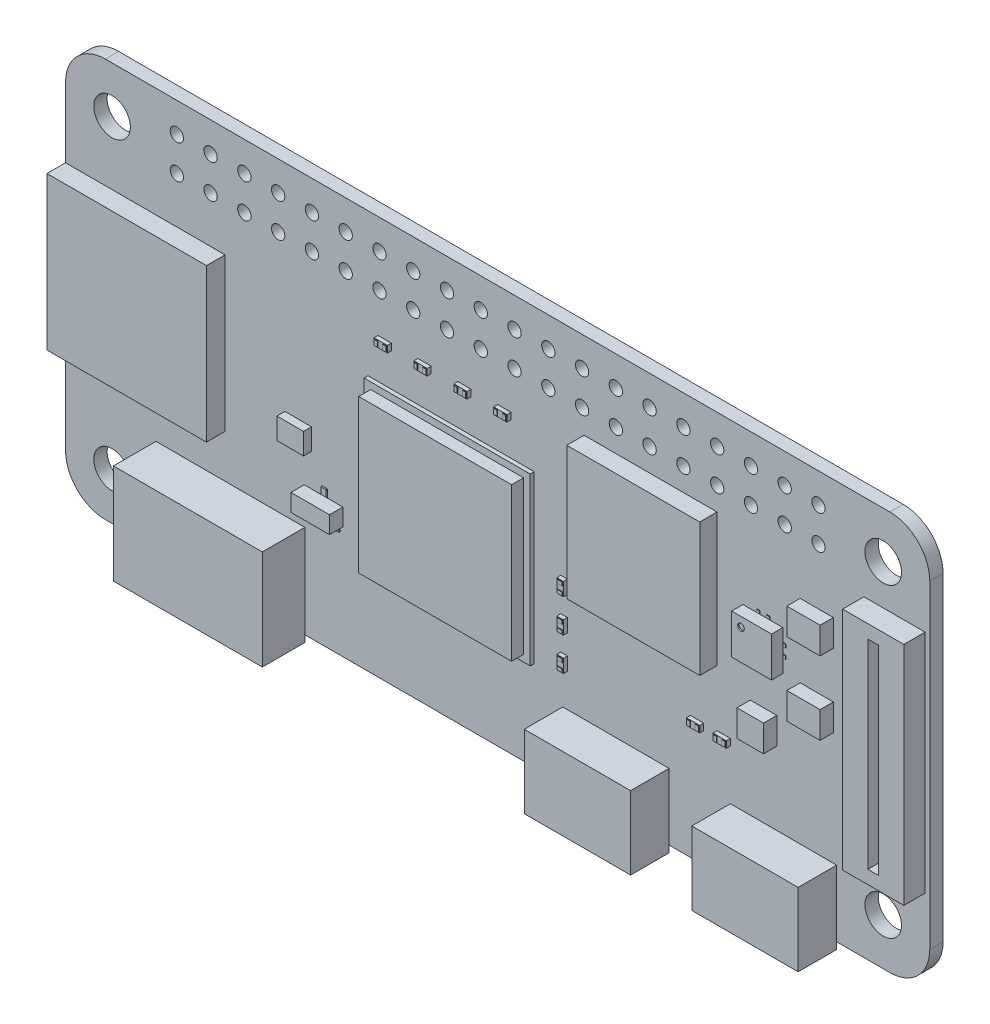
from build123d import *

# Parameters (mm, degrees)
PCB_DEPTH       = 1
SKETCH2_W       = 0.25
SKETCH2_H       = 0.3
SKETCH2_W_2     = 0.3
SKETCH2_H_2     = 0.25
SMD_ADD00_DEPTH = 0.05
SKETCH3_W       = 0.4
SKETCH3_H       = 0.7
SMD_ADD01_DEPTH = 0.1
SKETCH4_W       = 12.5
SKETCH4_H       = 12.5
SKETCH4_W_2     = 0.5
SKETCH4_H_2     = 1
SKETCH4_W_3     = 1
SKETCH4_H_3     = 0.5
SMD_ADD02_DEPTH = 0.3
SKETCH5_W       = 2
SKETCH5_H       = 1.6
SMD_ADD03_DEPTH = 0.6
SKETCH6_W       = 2.5
SKETCH6_H       = 2
SKETCH6_W_2     = 2
SMD_ADD04_DEPTH = 1
SKETCH7_W       = 10
SKETCH7_H       = 10
SMD_ADD05_DEPTH = 1.3
SKETCH8_W       = 12
SKETCH8_H       = 11.5
SMD_ADD06_DEPTH = 1.4
SKETCH9_W       = 4.6
SKETCH9_H       = 17
SMD_ADD07_DEPTH = 1.6
SKETCH10_W      = 8
SKETCH10_H      = 5.5
SMD_ADD08_DEPTH = 2.9
SKETCH11_W      = 11.2
SKETCH11_H      = 7.5
SMD_ADD09_DEPTH = 3.2
SKETCH12_W      = 3
SKETCH12_H      = 3
SMD_ADD10_DEPTH = 0.85
SKETCH13_W      = 2.9
SKETCH13_H      = 1.3
SMD_ADD11_DEPTH = 1
SKETCH14_W      = 0.4
SKETCH14_H      = 0.25
SKETCH14_W_2    = 0.25
SKETCH14_H_2    = 0.4
SMD_ADD12_DEPTH = 0.05
SKETCH15_W      = 11.5
SKETCH15_H      = 11.5
SMD_ADD13_DEPTH = 0.9
SKETCH16_W      = 4.2
SKETCH16_H      = 0.6
SMD_CUT00_DEPTH = 0.5
SKETCH17_W      = 5.5
SKETCH17_H      = 2
SKETCH17_W_2    = 4.2
SKETCH17_H_2    = 0.6
SMD_CUT01_DEPTH = 7
SKETCH18_R      = 0.25
SMD_CUT02_DEPTH = 0.1
SKETCH19_W      = 0.8
SKETCH19_H      = 15
SMD_CUT03_DEPTH = 1.1
SKETCH20_R      = 1.375
SKETCH20_R_2    = 0.5
HOLES_DEPTH     = 1


with BuildPart() as part:
    # Sketch1 → PCB (new body)
    with BuildSketch(Plane.XY):
        with BuildLine():
            Line((3, 0), (62, 0))
            ThreePointArc((62, 0), (64.121320344, 0.878679656), (65, 3))
            Line((65, 3), (65, 27))
            ThreePointArc((65, 27), (64.121320344, 29.121320344), (62, 30))
            Line((62, 30), (3, 30))
            ThreePointArc((3, 30), (0.878679656, 29.121320344), (0, 27))
            Line((0, 27), (0, 3))
            ThreePointArc((0, 3), (0.878679656, 0.878679656), (3, 0))
        make_face()
    extrude(amount=PCB_DEPTH)

    # Sketch2 → SMD_add00 (add)
    with BuildSketch(Plane.XY.offset(1)):
        with Locations((52.125, 15.45)):
            Rectangle(SKETCH2_W, SKETCH2_H)
        with Locations((50.95, 16.625)):
            Rectangle(SKETCH2_W_2, SKETCH2_H_2)
        with Locations((52.125, 18.55)):
            Rectangle(SKETCH2_W, SKETCH2_H)
        with Locations((54.05, 16.625)):
            Rectangle(SKETCH2_W_2, SKETCH2_H_2)
        with Locations((52.875, 15.45)):
            Rectangle(SKETCH2_W, SKETCH2_H)
        with Locations((50.95, 17.375)):
            Rectangle(SKETCH2_W_2, SKETCH2_H_2)
        with Locations((52.875, 18.55)):
            Rectangle(SKETCH2_W, SKETCH2_H)
        with Locations((54.05, 17.375)):
            Rectangle(SKETCH2_W_2, SKETCH2_H_2)
    extrude(amount=SMD_ADD00_DEPTH)

    # Sketch3 → SMD_add01 (add)
    with BuildSketch(Plane.XY.offset(1)):
        with Locations((18.55, 8.4)):
            Rectangle(SKETCH3_W, SKETCH3_H)
        with Locations((20.45, 8.4)):
            Rectangle(SKETCH3_W, SKETCH3_H)
        with Locations((19.5, 10)):
            Rectangle(SKETCH3_W, SKETCH3_H)
    extrude(amount=SMD_ADD01_DEPTH)

    # Sketch4 → SMD_add02 (add)
    with BuildSketch(Plane.XY.offset(1)):
        with Locations((29, 13)):
            Rectangle(SKETCH4_W, SKETCH4_H)
        with Locations((37.5, 8)):
            Rectangle(SKETCH4_W_2, SKETCH4_H_2)
        with Locations((37.5, 10.5)):
            Rectangle(SKETCH4_W_2, SKETCH4_H_2)
        with Locations((37.5, 13)):
            Rectangle(SKETCH4_W_2, SKETCH4_H_2)
        with Locations((47.5, 9)):
            Rectangle(SKETCH4_W_3, SKETCH4_H_3)
        with Locations((49.5, 9)):
            Rectangle(SKETCH4_W_3, SKETCH4_H_3)
        with Locations((24, 22)):
            Rectangle(SKETCH4_W_3, SKETCH4_H_3)
        with Locations((27, 22)):
            Rectangle(SKETCH4_W_3, SKETCH4_H_3)
        with Locations((30, 22)):
            Rectangle(SKETCH4_W_3, SKETCH4_H_3)
        with Locations((33, 22)):
            Rectangle(SKETCH4_W_3, SKETCH4_H_3)
    extrude(amount=SMD_ADD02_DEPTH)

    # Sketch5 → SMD_add03 (add)
    with BuildSketch(Plane.XY.offset(1)):
        with Locations((17.5, 13)):
            Rectangle(SKETCH5_W, SKETCH5_H)
    extrude(amount=SMD_ADD03_DEPTH)

    # Sketch6 → SMD_add04 (add)
    with BuildSketch(Plane.XY.offset(1)):
        with Locations((56.5, 20)):
            Rectangle(SKETCH6_W, SKETCH6_H)
        with Locations((56.5, 14.5)):
            Rectangle(SKETCH6_W, SKETCH6_H)
        with Locations((52.5, 11.5)):
            Rectangle(SKETCH6_W_2, SKETCH6_H)
    extrude(amount=SMD_ADD04_DEPTH)

    # Sketch7 → SMD_add05 (add)
    with BuildSketch(Plane.XY.offset(1)):
        with Locations((44, 18.5)):
            Rectangle(SKETCH7_W, SKETCH7_H)
    extrude(amount=SMD_ADD05_DEPTH)

    # Sketch8 → SMD_add06 (add)
    with BuildSketch(Plane.XY.offset(1)):
        with Locations((6, 16)):
            Rectangle(SKETCH8_W, SKETCH8_H)
    extrude(amount=SMD_ADD06_DEPTH)

    # Sketch9 → SMD_add07 (add)
    with BuildSketch(Plane.XY.offset(1)):
        with Locations((62.35, 15)):
            Rectangle(SKETCH9_W, SKETCH9_H)
    extrude(amount=SMD_ADD07_DEPTH)

    # Sketch10 → SMD_add08 (add)
    with BuildSketch(Plane.XY.offset(1)):
        with Locations((41.4, 2.25)):
            Rectangle(SKETCH10_W, SKETCH10_H)
        with Locations((54, 2.25)):
            Rectangle(SKETCH10_W, SKETCH10_H)
    extrude(amount=SMD_ADD08_DEPTH)

    # Sketch11 → SMD_add09 (add)
    with BuildSketch(Plane.XY.offset(1)):
        with Locations((12.4, 3.25)):
            Rectangle(SKETCH11_W, SKETCH11_H)
    extrude(amount=SMD_ADD09_DEPTH)

    # Sketch12 → SMD_add10 (add)
    with BuildSketch(Plane.XY.offset(1.05)):
        with Locations((52.5, 17)):
            Rectangle(SKETCH12_W, SKETCH12_H)
    extrude(amount=SMD_ADD10_DEPTH)

    # Sketch13 → SMD_add11 (add)
    with BuildSketch(Plane.XY.offset(1.1)):
        with Locations((19.5, 9.2)):
            Rectangle(SKETCH13_W, SKETCH13_H)
    extrude(amount=SMD_ADD11_DEPTH)

    # Sketch14 → SMD_add12 (add)
    with BuildSketch(Plane.XY.offset(1.3)):
        with Locations((37.5, 7.675)):
            Rectangle(SKETCH14_W, SKETCH14_H)
        with Locations((37.5, 8.325)):
            Rectangle(SKETCH14_W, SKETCH14_H)
        with Locations((37.5, 10.175)):
            Rectangle(SKETCH14_W, SKETCH14_H)
        with Locations((37.5, 10.825)):
            Rectangle(SKETCH14_W, SKETCH14_H)
        with Locations((37.5, 12.675)):
            Rectangle(SKETCH14_W, SKETCH14_H)
        with Locations((37.5, 13.325)):
            Rectangle(SKETCH14_W, SKETCH14_H)
        with Locations((47.175, 9)):
            Rectangle(SKETCH14_W_2, SKETCH14_H_2)
        with Locations((47.825, 9)):
            Rectangle(SKETCH14_W_2, SKETCH14_H_2)
        with Locations((49.175, 9)):
            Rectangle(SKETCH14_W_2, SKETCH14_H_2)
        with Locations((49.825, 9)):
            Rectangle(SKETCH14_W_2, SKETCH14_H_2)
        with Locations((23.675, 22)):
            Rectangle(SKETCH14_W_2, SKETCH14_H_2)
        with Locations((24.325, 22)):
            Rectangle(SKETCH14_W_2, SKETCH14_H_2)
        with Locations((26.675, 22)):
            Rectangle(SKETCH14_W_2, SKETCH14_H_2)
        with Locations((27.325, 22)):
            Rectangle(SKETCH14_W_2, SKETCH14_H_2)
        with Locations((29.675, 22)):
            Rectangle(SKETCH14_W_2, SKETCH14_H_2)
        with Locations((30.325, 22)):
            Rectangle(SKETCH14_W_2, SKETCH14_H_2)
        with Locations((32.675, 22)):
            Rectangle(SKETCH14_W_2, SKETCH14_H_2)
        with Locations((33.325, 22)):
            Rectangle(SKETCH14_W_2, SKETCH14_H_2)
    extrude(amount=SMD_ADD12_DEPTH)

    # Sketch15 → SMD_add13 (add)
    with BuildSketch(Plane.XY.offset(1.3)):
        with Locations((29, 13)):
            Rectangle(SKETCH15_W, SKETCH15_H)
    extrude(amount=SMD_ADD13_DEPTH)

    # Sketch16 → SMD_cut00 (cut)
    with BuildSketch(Plane(origin=(0, -0.5, 0), x_dir=(1, 0, 0), z_dir=(0, 1, 0))):
        with Locations((12.4, -2.6)):
            Rectangle(SKETCH16_W, SKETCH16_H)
    extrude(amount=SMD_CUT00_DEPTH, mode=Mode.SUBTRACT)

    # Sketch17 → SMD_cut01 (cut)
    with BuildSketch(Plane(origin=(0, 6.5, 0), x_dir=(1, 0, 0), z_dir=(0, 1, 0))):
        with Locations((12.4, -2.6)):
            Rectangle(SKETCH17_W, SKETCH17_H)
        with Locations((12.4, -2.6)):
            Rectangle(SKETCH17_W_2, SKETCH17_H_2, mode=Mode.SUBTRACT)
    extrude(amount=-SMD_CUT01_DEPTH, mode=Mode.SUBTRACT)

    # Sketch18 → SMD_cut02 (cut)
    with BuildSketch(Plane.XY.offset(1.9)):
        with Locations((51.7, 17.8)):
            Circle(SKETCH18_R)
    extrude(amount=-SMD_CUT02_DEPTH, mode=Mode.SUBTRACT)

    # Sketch19 → SMD_cut03 (cut)
    with BuildSketch(Plane.XY.offset(2.6)):
        with Locations((62.35, 15)):
            Rectangle(SKETCH19_W, SKETCH19_H)
    extrude(amount=-SMD_CUT03_DEPTH, mode=Mode.SUBTRACT)

    # Sketch20 → Holes (cut)
    with BuildSketch(Plane.XY.offset(1)):
        with Locations((3.5, 3.5)):
            Circle(SKETCH20_R)
        with Locations((61.5, 3.5)):
            Circle(SKETCH20_R)
        with Locations((3.5, 26.5)):
            Circle(SKETCH20_R)
        with Locations((61.5, 26.5)):
            Circle(SKETCH20_R)
        with Locations((8.37, 25.23)):
            Circle(SKETCH20_R_2)
        with Locations((8.37, 27.77)):
            Circle(SKETCH20_R_2)
        with Locations((10.91, 25.23)):
            Circle(SKETCH20_R_2)
        with Locations((10.91, 27.77)):
            Circle(SKETCH20_R_2)
        with Locations((13.45, 25.23)):
            Circle(SKETCH20_R_2)
        with Locations((13.45, 27.77)):
            Circle(SKETCH20_R_2)
        with Locations((15.99, 25.23)):
            Circle(SKETCH20_R_2)
        with Locations((15.99, 27.77)):
            Circle(SKETCH20_R_2)
        with Locations((18.53, 25.23)):
            Circle(SKETCH20_R_2)
        with Locations((18.53, 27.77)):
            Circle(SKETCH20_R_2)
        with Locations((21.07, 25.23)):
            Circle(SKETCH20_R_2)
        with Locations((21.07, 27.77)):
            Circle(SKETCH20_R_2)
        with Locations((23.61, 25.23)):
            Circle(SKETCH20_R_2)
        with Locations((23.61, 27.77)):
            Circle(SKETCH20_R_2)
        with Locations((26.15, 25.23)):
            Circle(SKETCH20_R_2)
        with Locations((26.15, 27.77)):
            Circle(SKETCH20_R_2)
        with Locations((28.69, 25.23)):
            Circle(SKETCH20_R_2)
        with Locations((28.69, 27.77)):
            Circle(SKETCH20_R_2)
        with Locations((31.23, 25.23)):
            Circle(SKETCH20_R_2)
        with Locations((31.23, 27.77)):
            Circle(SKETCH20_R_2)
        with Locations((33.77, 25.23)):
            Circle(SKETCH20_R_2)
        with Locations((33.77, 27.77)):
            Circle(SKETCH20_R_2)
        with Locations((36.31, 25.23)):
            Circle(SKETCH20_R_2)
        with Locations((36.31, 27.77)):
            Circle(SKETCH20_R_2)
        with Locations((38.85, 25.23)):
            Circle(SKETCH20_R_2)
        with Locations((38.85, 27.77)):
            Circle(SKETCH20_R_2)
        with Locations((41.39, 25.23)):
            Circle(SKETCH20_R_2)
        with Locations((41.39, 27.77)):
            Circle(SKETCH20_R_2)
        with Locations((43.93, 25.23)):
            Circle(SKETCH20_R_2)
        with Locations((43.93, 27.77)):
            Circle(SKETCH20_R_2)
        with Locations((46.47, 25.23)):
            Circle(SKETCH20_R_2)
        with Locations((46.47, 27.77)):
            Circle(SKETCH20_R_2)
        with Locations((49.01, 25.23)):
            Circle(SKETCH20_R_2)
        with Locations((49.01, 27.77)):
            Circle(SKETCH20_R_2)
        with Locations((51.55, 25.23)):
            Circle(SKETCH20_R_2)
        with Locations((51.55, 27.77)):
            Circle(SKETCH20_R_2)
        with Locations((54.09, 25.23)):
            Circle(SKETCH20_R_2)
        with Locations((54.09, 27.77)):
            Circle(SKETCH20_R_2)
        with Locations((56.63, 25.23)):
            Circle(SKETCH20_R_2)
        with Locations((56.63, 27.77)):
            Circle(SKETCH20_R_2)
    extrude(amount=-HOLES_DEPTH, mode=Mode.SUBTRACT)


solid = part.part
